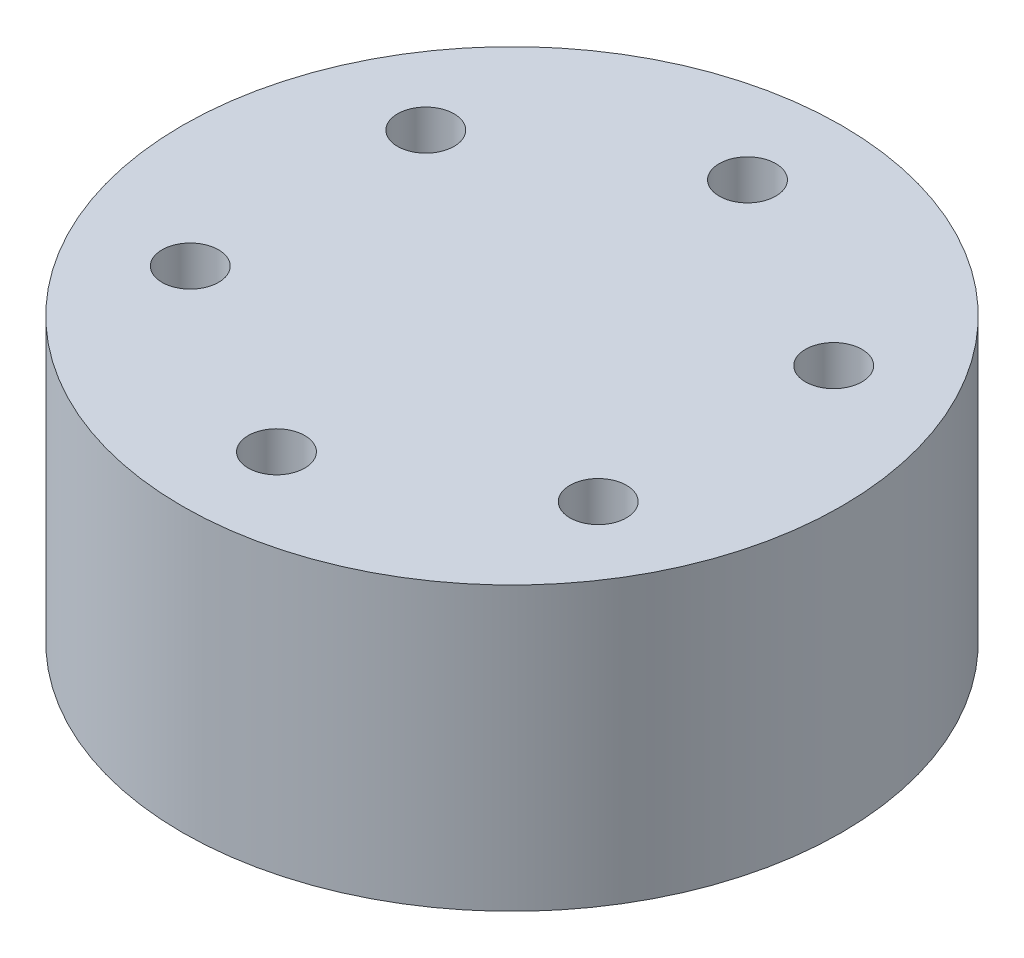
from build123d import *

# Parameters (mm, degrees)
SKETCH_5_R          = 17.5
EXTRUDE_1_DEPTH     = 15
SKETCH_6_R          = 1.5
CUT_EXTRUDE_1_DEPTH = 5


with BuildPart() as part:
    # Эскиз5 → Бобышка-Вытянуть1 (new body)
    with BuildSketch(Plane(origin=(0, 0, 0), x_dir=(1, 0, 0), z_dir=(0, 1, 0))):
        with Locations(Location((0, 0, 0), (0, 0, 270))):
            Circle(SKETCH_5_R)
    extrude(amount=EXTRUDE_1_DEPTH)

    # Эскиз6 → Вырез-Вытянуть1 (cut)
    with BuildSketch(Plane(origin=(0, 15, 0), x_dir=(1, 0, 0), z_dir=(0, 1, 0))):
        with Locations(Location((0, 12.5, 0), (0, 0, 270))):
            Circle(SKETCH_6_R)
        with Locations(Location((10.825317547, 6.25, 0), (0, 0, 270))):
            Circle(SKETCH_6_R)
        with Locations(Location((10.825317547, -6.25, 0), (0, 0, 270))):
            Circle(SKETCH_6_R)
        with Locations(Location((0, -12.5, 0), (0, 0, 270))):
            Circle(SKETCH_6_R)
        with Locations(Location((-10.825317547, -6.25, 0), (0, 0, 270))):
            Circle(SKETCH_6_R)
        with Locations(Location((-10.825317547, 6.25, 0), (0, 0, 270))):
            Circle(SKETCH_6_R)
    extrude(amount=-CUT_EXTRUDE_1_DEPTH, mode=Mode.SUBTRACT)


solid = part.part
